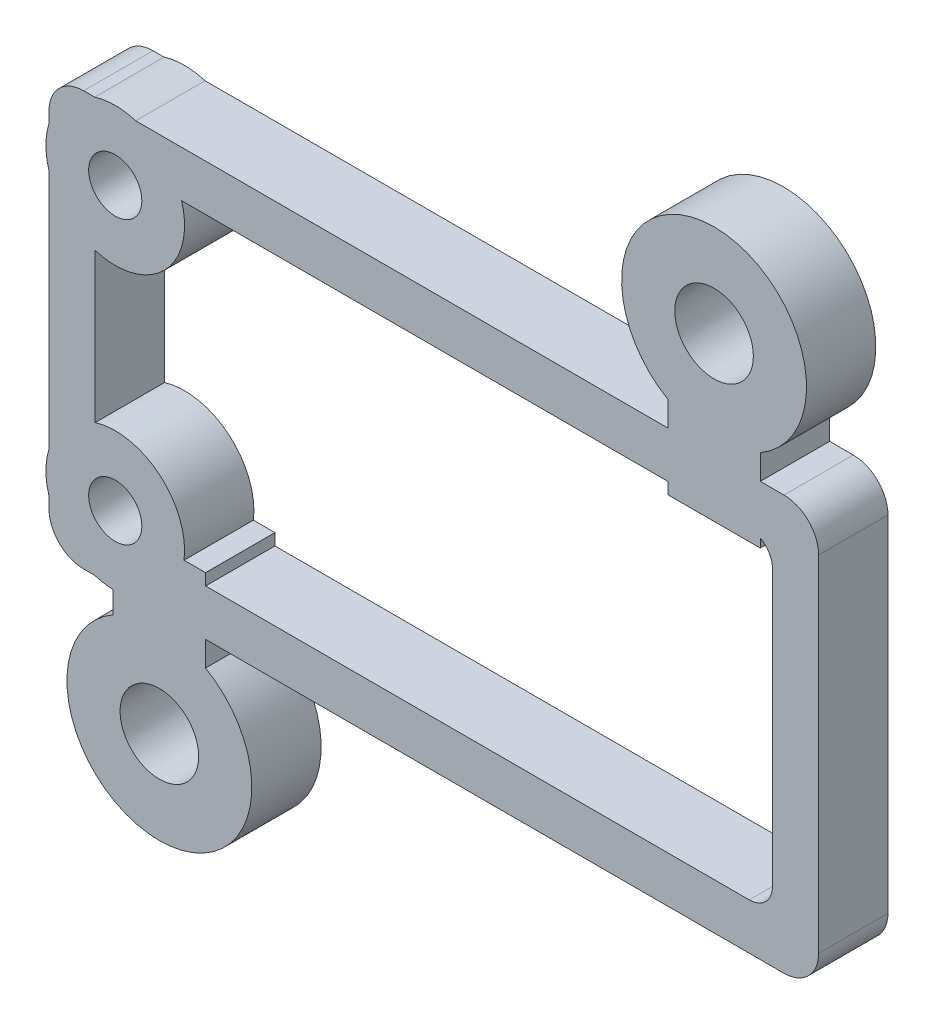
from build123d import *

# Parameters (mm, degrees)
PCB_EDGE_SUPPORT_DEPTH       = 3
SKETCH_2_R                   = 3
PCB_SCREW_LANDS_DEPTH        = 3
SKETCH_3_W                   = 4
SKETCH_3_H                   = 7.04
FLOATING_MOUNT_BRIDGES_DEPTH = 3
SKETCH_4_R                   = 4
FLOATING_MOUNT_EARS_DEPTH    = 3
SKETCH_5_R                   = 1.15
PCB_M2_CLEARANCE_DEPTH       = 4
SKETCH_6_R                   = 1.7
M2_ADJUSTMENT_0P7_DEPTH      = 4


with BuildPart() as part:
    # 草图1 → PCB_edge_support (new body)
    with BuildSketch(Plane.XY):
        with BuildLine():
            Line((1, -0.5), (31.3, -0.5))
            ThreePointArc((31.3, -0.5), (32.360660172, -0.060660172), (32.8, 1))
            Line((32.8, 1), (32.8, 15.92))
            ThreePointArc((32.8, 15.92), (32.360660172, 16.980660172), (31.3, 17.42))
            Line((31.3, 17.42), (1, 17.42))
            ThreePointArc((1, 17.42), (-0.060660172, 16.980660172), (-0.5, 15.92))
            Line((-0.5, 15.92), (-0.5, 1))
            ThreePointArc((-0.5, 1), (-0.060660172, -0.060660172), (1, -0.5))
        make_face()
        with BuildLine():
            Line((2.5, 1.5), (29.8, 1.5))
            ThreePointArc((29.8, 1.5), (30.507106781, 1.792893219), (30.8, 2.5))
            Line((30.8, 2.5), (30.8, 14.42))
            ThreePointArc((30.8, 14.42), (30.507106781, 15.127106781), (29.8, 15.42))
            Line((29.8, 15.42), (2.5, 15.42))
            ThreePointArc((2.5, 15.42), (1.792893219, 15.127106781), (1.5, 14.42))
            Line((1.5, 14.42), (1.5, 2.5))
            ThreePointArc((1.5, 2.5), (1.792893219, 1.792893219), (2.5, 1.5))
        make_face(mode=Mode.SUBTRACT)
    extrude(amount=PCB_EDGE_SUPPORT_DEPTH)

    # 草图2 → PCB_screw_lands (add)
    with BuildSketch(Plane.XY):
        with Locations((2.365, 2.365)):
            Circle(SKETCH_2_R)
        with Locations((2.365, 14.555)):
            Circle(SKETCH_2_R)
    extrude(amount=PCB_SCREW_LANDS_DEPTH)

    # 草图3 → Floating_mount_bridges (add)
    with BuildSketch(Plane.XY):
        with Locations((4.275, -1.52)):
            Rectangle(SKETCH_3_W, SKETCH_3_H)
        with Locations((28.275, 18.44)):
            Rectangle(SKETCH_3_W, SKETCH_3_H)
    extrude(amount=FLOATING_MOUNT_BRIDGES_DEPTH)

    # 草图4 → Floating_mount_ears (add)
    with BuildSketch(Plane.XY):
        with Locations((4.275, -5.04)):
            Circle(SKETCH_4_R)
        with Locations((28.275, 21.96)):
            Circle(SKETCH_4_R)
    extrude(amount=FLOATING_MOUNT_EARS_DEPTH)

    # 草图5 → PCB_M2_clearance (cut)
    with BuildSketch(Plane.XY):
        with Locations((2.365, 2.365)):
            Circle(SKETCH_5_R)
        with Locations((2.365, 14.555)):
            Circle(SKETCH_5_R)
    extrude(amount=PCB_M2_CLEARANCE_DEPTH, mode=Mode.SUBTRACT)

    # 草图6 → M2_adjustment_0p7 (cut)
    with BuildSketch(Plane.XY):
        with Locations((4.275, -5.04)):
            Circle(SKETCH_6_R)
        with Locations((28.275, 21.96)):
            Circle(SKETCH_6_R)
    extrude(amount=M2_ADJUSTMENT_0P7_DEPTH, mode=Mode.SUBTRACT)


solid = part.part
